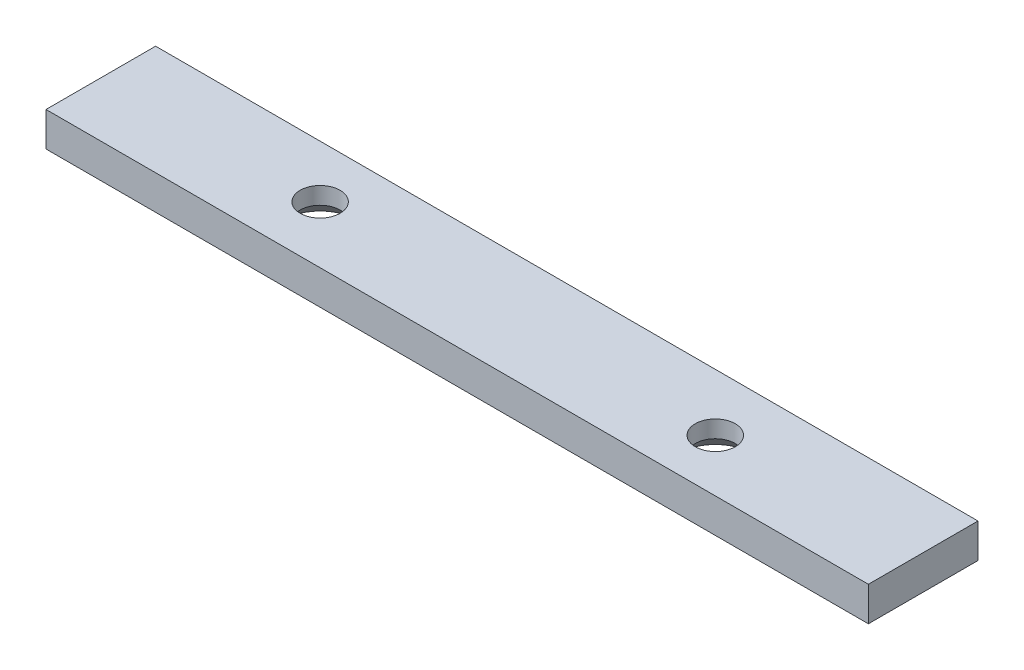
from build123d import *

# Parameters (mm, degrees)
SKETCH1_R           = 3.5
BOSS_EXTRUDE1_DEPTH = 6
CHAMFER1_SIZE       = 3


with BuildPart() as part:
    # Sketch1 → Boss-Extrude1 (new body)
    with BuildSketch(Plane(origin=(0, 0, 0), x_dir=(1, 0, 0), z_dir=(0, 1, 0))):
        Polygon((144, 19.194168848), (0, 19.194168848), (0, 0), (38, 0), (108, 0), (144, 0), align=None)
        with Locations(Location((108, 9.194168848, 0), (0, 0, 270))):
            Circle(SKETCH1_R, mode=Mode.SUBTRACT)
        with Locations(Location((38, 10, 0), (0, 0, 270))):
            Circle(SKETCH1_R, mode=Mode.SUBTRACT)
    extrude(amount=BOSS_EXTRUDE1_DEPTH)

    # Chamfer1
    chamfer1_edges = [part.edges().sort_by_distance(p)[0] for p in [
        (38, 0, -13.5),
        (108, 0, -12.694168848),
    ]]
    chamfer(chamfer1_edges, length=CHAMFER1_SIZE)


solid = part.part
